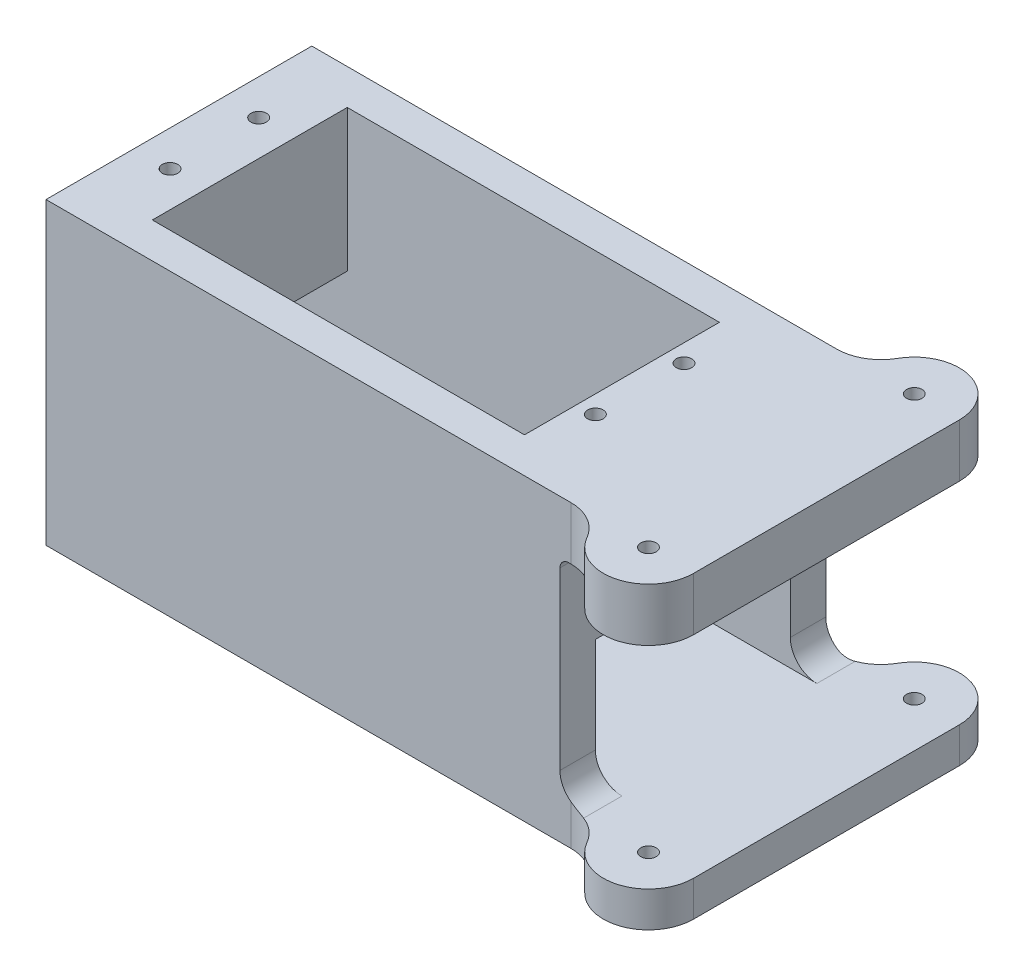
from build123d import *

# Parameters (mm, degrees)
SKETCH2_W           = 50
SKETCH2_H           = 30
SKETCH2_W_2         = 42
SKETCH2_H_2         = 22
BOSS_EXTRUDE1_DEPTH = 28.8
SKETCH3_W           = 50
SKETCH3_H           = 30
BOSS_EXTRUDE2_DEPTH = 4
SKETCH4_W           = 22
SKETCH4_H           = 17.8
CUT_EXTRUDE1_DEPTH  = 4
SKETCH5_W           = 30
SKETCH5_H           = 32.8
BOSS_EXTRUDE3_DEPTH = 4
BOSS_EXTRUDE4_DEPTH = 4
SKETCH7_R           = 0.875
CUT_EXTRUDE2_DEPTH  = 10
SKETCH8_R           = 0.875
BOSS_EXTRUDE5_DEPTH = 4
FILLET1_R           = 3
BOSS_EXTRUDE6_START = -5
SKETCH9_R           = 0.875
BOSS_EXTRUDE6_DEPTH = 5
FILLET2_R           = 1
SKETCH11_R          = 0.875
SKETCH11_W          = 42
SKETCH11_H          = 22
BOSS_EXTRUDE7_DEPTH = 1
SKETCH14_R          = 5
CUT_EXTRUDE3_DEPTH  = 37
SKETCH17_R          = 7.5
CUT_EXTRUDE4_DEPTH  = 57.873262079
SKETCH18_R          = 5
BOSS_EXTRUDE9_DEPTH = 4
CUT_EXTRUDE5_DEPTH  = 75.343138703


with BuildPart() as part:
    # Sketch2 → Boss-Extrude1 (new body)
    with BuildSketch(Plane(origin=(0, 0, 0), x_dir=(1, 0, 0), z_dir=(0, 1, 0))):
        Rectangle(SKETCH2_W, SKETCH2_H)
        Rectangle(SKETCH2_W_2, SKETCH2_H_2, mode=Mode.SUBTRACT)
    extrude(amount=BOSS_EXTRUDE1_DEPTH)

    # Sketch3 → Boss-Extrude2 (add)
    with BuildSketch(Plane.XZ):
        Rectangle(SKETCH3_W, SKETCH3_H)
    extrude(amount=BOSS_EXTRUDE2_DEPTH)

    # Sketch4 → Cut-Extrude1 (cut)
    with BuildSketch(Plane(origin=(25, 0, 0), x_dir=(0, 0, -1), z_dir=(1, 0, 0))):
        with Locations((0, 4.9)):
            Rectangle(SKETCH4_W, SKETCH4_H)
    extrude(amount=-CUT_EXTRUDE1_DEPTH, mode=Mode.SUBTRACT)

    # Sketch5 → Boss-Extrude3 (add)
    with BuildSketch(Plane.ZY.offset(25)):
        with Locations((0, 12.4)):
            Rectangle(SKETCH5_W, SKETCH5_H)
    extrude(amount=BOSS_EXTRUDE3_DEPTH)

    # Sketch6 → Boss-Extrude4 (add)
    with BuildSketch(Plane(origin=(25, 0, 0), x_dir=(0, 0, -1), z_dir=(1, 0, 0))):
        Polygon((-15, -4), (-11, -4), (-11, 13.8), (11, 13.8), (11, -4), (15, -4), (15, 28.8), (-15, 28.8), align=None)
    extrude(amount=BOSS_EXTRUDE4_DEPTH)

    # Sketch7 → Cut-Extrude2 (cut)
    with BuildSketch(Plane(origin=(0, 28.8, 0), x_dir=(1, 0, 0), z_dir=(0, 1, 0))):
        with Locations(Location((23, -5, 0), (0, 0, 270))):
            Circle(SKETCH7_R)
        with Locations(Location((23, 5, 0), (0, 0, 270))):
            Circle(SKETCH7_R)
        with Locations(Location((-25, 5, 0), (0, 0, 270))):
            Circle(SKETCH7_R)
        with Locations(Location((-25, -5, 0), (0, 0, 270))):
            Circle(SKETCH7_R)
    extrude(amount=-CUT_EXTRUDE2_DEPTH, mode=Mode.SUBTRACT)

    # Sketch8 → Boss-Extrude5 (add)
    with BuildSketch(Plane.XZ.offset(4)):
        with BuildLine():
            Line((20.903006959, -15), (30.229257675, -15))
            ThreePointArc((30.229257675, -15), (32.740161395, -15.676186578), (34.571929358, -17.521854998))
            ThreePointArc((34.571929358, -17.521854998), (40.295729423, -19.918118011), (44.079388874, -15))
            Line((44.079388874, -15), (44.079388874, 15))
            ThreePointArc((44.079388874, 15), (40.295729423, 19.918118011), (34.571929358, 17.521854998))
            ThreePointArc((34.571929358, 17.521854998), (32.740161395, 15.676186578), (30.229257675, 15))
            Line((30.229257675, 15), (20.903006959, 15))
            Line((20.903006959, 15), (20.903006959, -15))
        make_face()
        with Locations(Location((38.991197916, 15, 0), (0, 0, 270))):
            Circle(SKETCH8_R, mode=Mode.SUBTRACT)
        with Locations(Location((38.991197916, -15, 0), (0, 0, 270))):
            Circle(SKETCH8_R, mode=Mode.SUBTRACT)
    extrude(amount=-BOSS_EXTRUDE5_DEPTH)

    # Fillet1
    fillet1_edges = [part.edges().sort_by_distance(p)[0] for p in [
        (29, 0, -13),
        (29, 0, 13),
    ]]
    fillet(fillet1_edges, radius=FILLET1_R)

    # Sketch9 → Boss-Extrude6 (add)
    with BuildSketch(Plane(origin=(0, 28.8, 0), x_dir=(1, 0, 0), z_dir=(0, 1, 0)).offset(BOSS_EXTRUDE6_START)):
        with BuildLine():
            Line((30.229257675, 15), (26.332891716, 15))
            Line((26.332891716, 15), (26.332891716, -15))
            Line((26.332891716, -15), (30.229257675, -15))
            ThreePointArc((30.229257675, -15), (31.129332579, -15.081680656), (32, -15.324053934))
            ThreePointArc((32, -15.324053934), (33.477494133, -16.198821247), (34.571929358, -17.521854998))
            ThreePointArc((34.571929358, -17.521854998), (40.295729423, -19.918118011), (44.079388874, -15))
            Line((44.079388874, -15), (44.079388874, 15))
            ThreePointArc((44.079388874, 15), (40.295729423, 19.918118011), (34.571929358, 17.521854998))
            ThreePointArc((34.571929358, 17.521854998), (33.477494133, 16.198821247), (32, 15.324053934))
            ThreePointArc((32, 15.324053934), (31.129332579, 15.081680656), (30.229257675, 15))
        make_face()
        with Locations(Location((38.991197916, -15, 0), (0, 0, 90))):
            Circle(SKETCH9_R, mode=Mode.SUBTRACT)
        with Locations(Location((38.991197916, 15, 0), (0, 0, 90))):
            Circle(SKETCH9_R, mode=Mode.SUBTRACT)
    extrude(amount=BOSS_EXTRUDE6_DEPTH)

    # Fillet2
    fillet2_edges = [part.edges().sort_by_distance(p)[0] for p in [
        (29, 23.8, 0),
    ]]
    fillet(fillet2_edges, radius=FILLET2_R)

    # Sketch11 → Boss-Extrude7 (add)
    with BuildSketch(Plane(origin=(0, 28.8, 0), x_dir=(1, 0, 0), z_dir=(0, 1, 0))):
        with BuildLine():
            Line((-29, -15), (30.229257675, -15))
            ThreePointArc((30.229257675, -15), (32.740161395, -15.676186578), (34.571929358, -17.521854998))
            ThreePointArc((34.571929358, -17.521854998), (40.295729423, -19.918118011), (44.079388874, -15))
            Line((44.079388874, -15), (44.079388874, 15))
            ThreePointArc((44.079388874, 15), (40.295729423, 19.918118011), (34.571929358, 17.521854998))
            ThreePointArc((34.571929358, 17.521854998), (32.740161395, 15.676186578), (30.229257675, 15))
            Line((30.229257675, 15), (-29, 15))
            Line((-29, 15), (-29, -15))
        make_face()
        with Locations(Location((-25, 5, 0), (0, 0, 270))):
            Circle(SKETCH11_R, mode=Mode.SUBTRACT)
        with Locations(Location((-25, -5, 0), (0, 0, 270))):
            Circle(SKETCH11_R, mode=Mode.SUBTRACT)
        with Locations(Location((23, 5, 0), (0, 0, 270))):
            Circle(SKETCH11_R, mode=Mode.SUBTRACT)
        with Locations(Location((23, -5, 0), (0, 0, 270))):
            Circle(SKETCH11_R, mode=Mode.SUBTRACT)
        with Locations(Location((38.991197916, -15, 0), (0, 0, 90))):
            Circle(SKETCH11_R, mode=Mode.SUBTRACT)
        with Locations(Location((38.991197916, 15, 0), (0, 0, 90))):
            Circle(SKETCH11_R, mode=Mode.SUBTRACT)
        Rectangle(SKETCH11_W, SKETCH11_H, mode=Mode.SUBTRACT)
    extrude(amount=BOSS_EXTRUDE7_DEPTH)

    # Sketch14 → Cut-Extrude3 (cut)
    with BuildSketch(Plane.XZ.offset(4)):
        with Locations(Location((10.09, 0, 0), (0, 0, 270))):
            Circle(SKETCH14_R)
    extrude(amount=-CUT_EXTRUDE3_DEPTH, mode=Mode.SUBTRACT)

    # Sketch17 → Cut-Extrude4 (cut, through all)
    with BuildSketch(Plane(origin=(0, 0, 0), x_dir=(1, 0, 0), z_dir=(0, 1, 0))):
        with Locations(Location((-10.09, 0, 0), (0, 0, 90))):
            Circle(SKETCH17_R)
    extrude(amount=-CUT_EXTRUDE4_DEPTH, mode=Mode.SUBTRACT)

    # Sketch18 → Boss-Extrude9 (add)
    with BuildSketch(Plane.XZ.offset(4)):
        with Locations((10.09, 0)):
            Circle(SKETCH18_R)
    extrude(amount=-BOSS_EXTRUDE9_DEPTH)

    # Sketch19 → Cut-Extrude5 (cut, through all)
    with BuildSketch(Plane(origin=(-21, 0, 0), x_dir=(0, 0, -1), z_dir=(1, 0, 0))):
        Polygon((-11, 13.8), (11, 13.8), (11, 0), (-11, 0), (-11, 3), align=None)
    extrude(amount=-CUT_EXTRUDE5_DEPTH, mode=Mode.SUBTRACT)


solid = part.part
